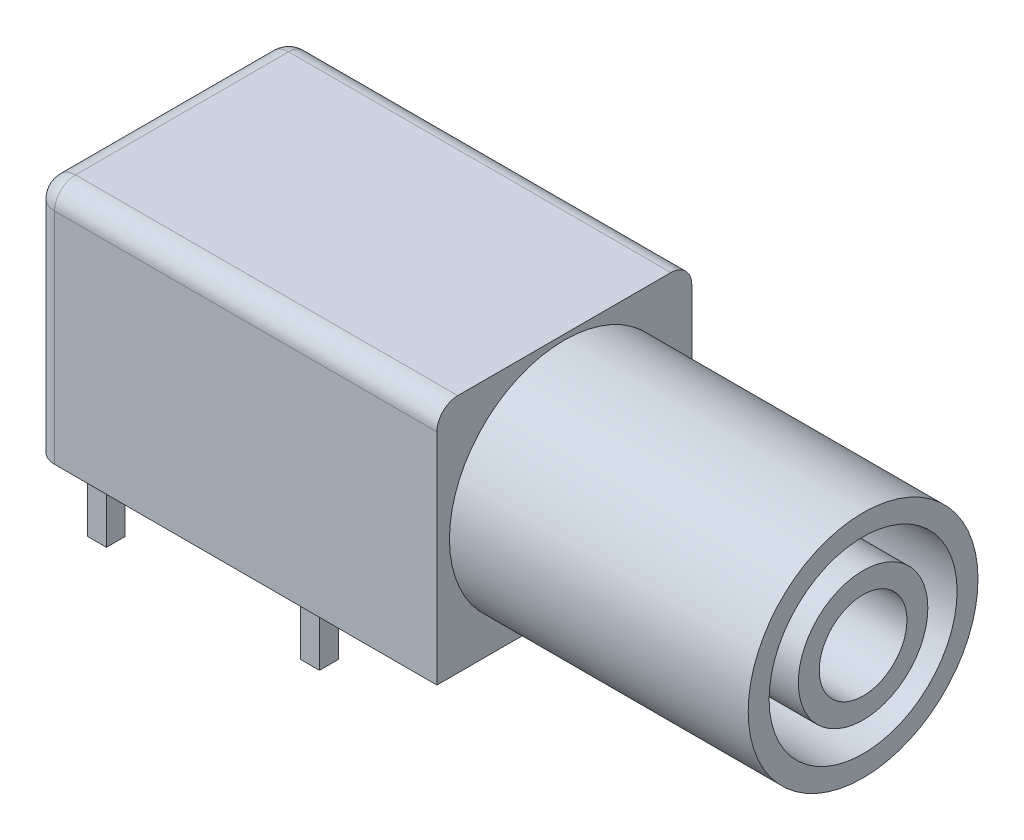
from build123d import *

# Parameters (mm, degrees)
SKETCH_1_W               = 19.3
SKETCH_1_H               = 12.2
EXTRUDE_1_DEPTH          = 11.5
FILLET_4_R               = 1
SKETCH_2_R               = 5.5
EXTRUDE_2_DEPTH          = 14.3
SKETCH_3_R               = 4.5
CUT_EXTRUDE_1_DEPTH      = 14.3
SKETCH_4_R               = 3.1
SKETCH_4_R_2             = 2.1
EXTRUDE_3_DEPTH          = 14.3
SKETCH_5_W               = 1.5
SKETCH_5_H               = 0.9
EXTRUDE_4_DEPTH          = 0.9
SKETCH_6_W               = 0.9
SKETCH_6_H               = 0.9
EXTRUDE_5_DEPTH          = 2.4
PATTERN_LINEAR_1_COUNT   = 2
PATTERN_LINEAR_1_PITCH   = 9.1
MIRROR_1_COPY_1_SKETCH_W = 1.5
MIRROR_1_COPY_1_SKETCH_H = 0.9
MIRROR_1_COPY_1_DEPTH    = 0.9
MIRROR_1_COPY_2_SKETCH_W = 0.9
MIRROR_1_COPY_2_SKETCH_H = 0.9
MIRROR_1_COPY_2_DEPTH    = 2.4
SKETCH_7_R               = 1
EXTRUDE_6_DEPTH          = 3.3


with BuildPart() as part:
    # Эскиз1 → Бобышка-Вытянуть1 (new body)
    with BuildSketch(Plane(origin=(0, 0, 0), x_dir=(1, 0, 0), z_dir=(0, 1, 0))):
        Rectangle(SKETCH_1_W, SKETCH_1_H)
    extrude(amount=EXTRUDE_1_DEPTH)

    # Скругление4
    fillet_4_edges = [part.edges().sort_by_distance(p)[0] for p in [
        (-9.65, 11.5, 0),
        (0, 11.5, 6.1),
        (-9.65, 5.75, 6.1),
        (-9.65, 5.75, -6.1),
        (0, 11.5, -6.1),
    ]]
    fillet(fillet_4_edges, radius=FILLET_4_R)

    # Эскиз2 → Бобышка-Вытянуть2 (add)
    with BuildSketch(Plane(origin=(9.65, 0, 0), x_dir=(0, 0, -1), z_dir=(1, 0, 0))):
        with Locations((0, 5.75)):
            Circle(SKETCH_2_R)
    extrude(amount=EXTRUDE_2_DEPTH)

    # Эскиз3 → Вырез-Вытянуть1 (cut)
    with BuildSketch(Plane(origin=(23.95, 0, 0), x_dir=(0, 0, -1), z_dir=(1, 0, 0))):
        with Locations((0, 5.75)):
            Circle(SKETCH_3_R)
    extrude(amount=-CUT_EXTRUDE_1_DEPTH, mode=Mode.SUBTRACT)

    # Эскиз4 → Бобышка-Вытянуть3 (add)
    with BuildSketch(Plane(origin=(9.65, 0, 0), x_dir=(0, 0, -1), z_dir=(1, 0, 0))):
        with Locations((0, 5.75)):
            Circle(SKETCH_4_R)
        with Locations((0, 5.75)):
            Circle(SKETCH_4_R_2, mode=Mode.SUBTRACT)
    extrude(amount=EXTRUDE_3_DEPTH)

    # Эскиз5 → Бобышка-Вытянуть4 (add)
    with BuildSketch(Plane.XZ):
        with Locations((-7.42, 4.55)):
            Rectangle(SKETCH_5_W, SKETCH_5_H)
    extrude_4 = extrude(amount=EXTRUDE_4_DEPTH)

    # Эскиз6 → Бобышка-Вытянуть5 (add)
    with BuildSketch(Plane.XZ.offset(0.9)):
        with Locations((-7.72, 4.55)):
            Rectangle(SKETCH_6_W, SKETCH_6_H)
    extrude_5 = extrude(amount=EXTRUDE_5_DEPTH)

    # Линейный массив1: Бобышка-Вытянуть4, Бобышка-Вытянуть5 ×2
    with Locations(*[(0, 0, -i * PATTERN_LINEAR_1_PITCH) for i in range(1, PATTERN_LINEAR_1_COUNT)]):
        add(extrude_4)
        add(extrude_5)

    # Зеркальное отражение1: Бобышка-Вытянуть4, Бобышка-Вытянуть5 across plane
    add(extrude_4.mirror(Plane(origin=(-2.62, 0, 0), x_dir=(0, 0, 1), z_dir=(1, 0, 0))))
    add(extrude_5.mirror(Plane(origin=(-2.62, 0, 0), x_dir=(0, 0, 1), z_dir=(1, 0, 0))))

    # Зеркальное отражение1 copy 1 sketch → Зеркальное отражение1 copy 1 (add)
    with BuildSketch(Plane(origin=(-5.24, 0, -9.1), x_dir=(-1, 0, 0), z_dir=(0, -1, 0))):
        with Locations((-7.42, -4.55)):
            Rectangle(MIRROR_1_COPY_1_SKETCH_W, MIRROR_1_COPY_1_SKETCH_H)
    extrude(amount=MIRROR_1_COPY_1_DEPTH)

    # Зеркальное отражение1 copy 2 sketch → Зеркальное отражение1 copy 2 (add)
    with BuildSketch(Plane(origin=(-5.24, -0.9, -9.1), x_dir=(-1, 0, 0), z_dir=(0, -1, 0))):
        with Locations((-7.72, -4.55)):
            Rectangle(MIRROR_1_COPY_2_SKETCH_W, MIRROR_1_COPY_2_SKETCH_H)
    extrude(amount=MIRROR_1_COPY_2_DEPTH)

    # Эскиз7 → Бобышка-Вытянуть6 (add)
    with BuildSketch(Plane.XZ):
        with Locations(Location((-4.95, 0, 0), (0, 0, 90))):
            Circle(SKETCH_7_R)
    extrude(amount=EXTRUDE_6_DEPTH)


solid = part.part
